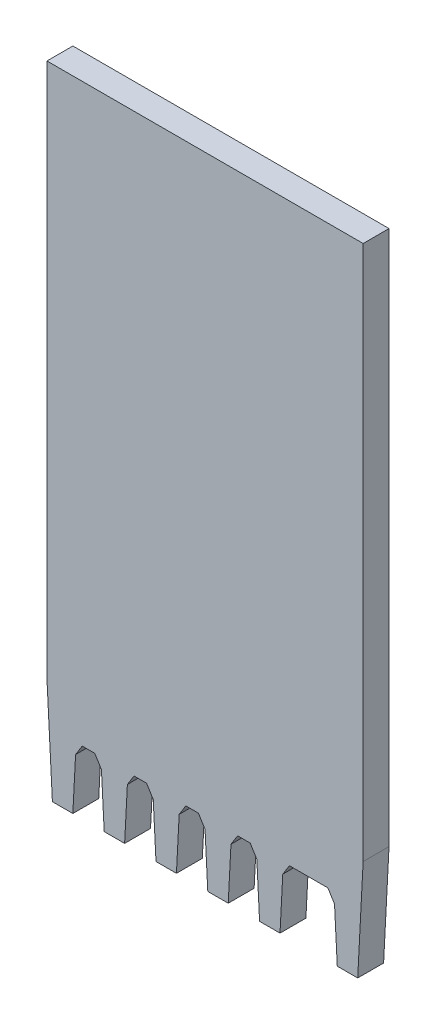
from build123d import *

# Parameters (mm, degrees)
BOSS_EXTRUDE1_DEPTH = 1.5


with BuildPart() as part:
    # Sketch1 → Boss-Extrude1 (new body)
    with BuildSketch(Plane.XY):
        Polygon((0, 6), (0.314446676, 0), (1.497941481, 0), (1.657221927, 3.039251967), (2.042586863, 3.65596478), (2.769801294, 3.65596478), (3.155166229, 3.039251967), (3.314446676, 0), (4.497941481, 0), (4.657221927, 3.039251967), (5.042586863, 3.65596478), (5.769801294, 3.65596478), (6.155166229, 3.039251967), (6.314446676, 0), (7.497941481, 0), (7.657221927, 3.039251967), (8.042586863, 3.65596478), (8.769801294, 3.65596478), (9.155166229, 3.039251967), (9.314446676, 0), (10.497941481, 0), (10.657221927, 3.039251967), (11.042586863, 3.65596478), (11.769801294, 3.65596478), (12.155166229, 3.039251967), (12.314446676, 0), (13.497941481, 0), (13.657221927, 3.039251967), (14.042586863, 3.65596478), (16.269801294, 3.65596478), (16.655166229, 3.039251967), (16.814446676, 0), (17.997941481, 0), (18.312388157, 6), (18.312388157, 37), (0, 37), align=None)
    extrude(amount=BOSS_EXTRUDE1_DEPTH)


solid = part.part
